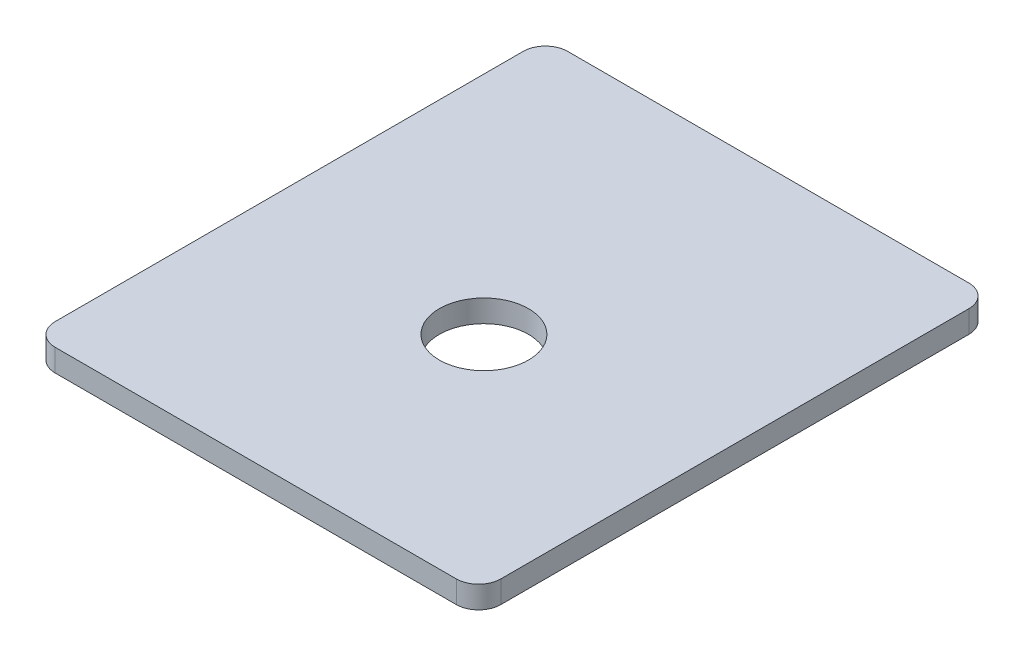
from build123d import *

# Parameters (mm, degrees)
SKETCH1_R               = 4
BOSS_EXTRUDE1_DEPTH     = 2
SKETCH5_W               = 40
SKETCH5_H               = 2
BOSS_EXTRUDE5_DEPTH     = 40
CUT_EXTRUDE4_DEPTH      = 64.976558207
CUT_EXTRUDE4_DEPTH_BACK = 52
SKETCH8_W               = 2
SKETCH8_H               = 42
FILLET1_R               = 2
FILLET2_R               = 2


with BuildPart() as part:
    # Sketch1 → Boss-Extrude1 (new body)
    with BuildSketch(Plane(origin=(0, 0, 0), x_dir=(1, 0, 0), z_dir=(0, 1, 0))):
        with BuildLine():
            Line((-20, -21), (-20, -27))
            Line((-20, -27), (20, -27))
            Line((20, -27), (20, -21))
            Line((20, -21), (20, 19))
            ThreePointArc((20, 19), (19.414213562, 20.414213562), (18, 21))
            Line((18, 21), (-18, 21))
            ThreePointArc((-18, 21), (-19.414213562, 20.414213562), (-20, 19))
            Line((-20, 19), (-20, -21))
        make_face()
        with Locations(Location((0.232716016, -4.751871967, 0), (0, 0, 270))):
            Circle(SKETCH1_R, mode=Mode.SUBTRACT)
    extrude(amount=BOSS_EXTRUDE1_DEPTH)

    # Sketch5 → Boss-Extrude5 (add)
    with BuildSketch(Plane(origin=(0, 2, 0), x_dir=(1, 0, 0), z_dir=(0, 1, 0))):
        with Locations((0, -26)):
            Rectangle(SKETCH5_W, SKETCH5_H)
    extrude(amount=BOSS_EXTRUDE5_DEPTH)

    # Sketch8 → Cut-Extrude4 (cut, two sides: drawn at the far end of the back side and taken through both)
    with BuildSketch(Plane.ZY.offset(20).offset(-CUT_EXTRUDE4_DEPTH_BACK)):
        with Locations((26, 21)):
            Rectangle(SKETCH8_W, SKETCH8_H)
    extrude(amount=CUT_EXTRUDE4_DEPTH + CUT_EXTRUDE4_DEPTH_BACK, mode=Mode.SUBTRACT)

    # Fillet1
    fillet1_edges = [part.edges().sort_by_distance(p)[0] for p in [
        (-20, 1, 25),
    ]]
    fillet(fillet1_edges, radius=FILLET1_R)

    # Fillet2
    fillet2_edges = [part.edges().sort_by_distance(p)[0] for p in [
        (20, 1, 25),
    ]]
    fillet(fillet2_edges, radius=FILLET2_R)


solid = part.part
